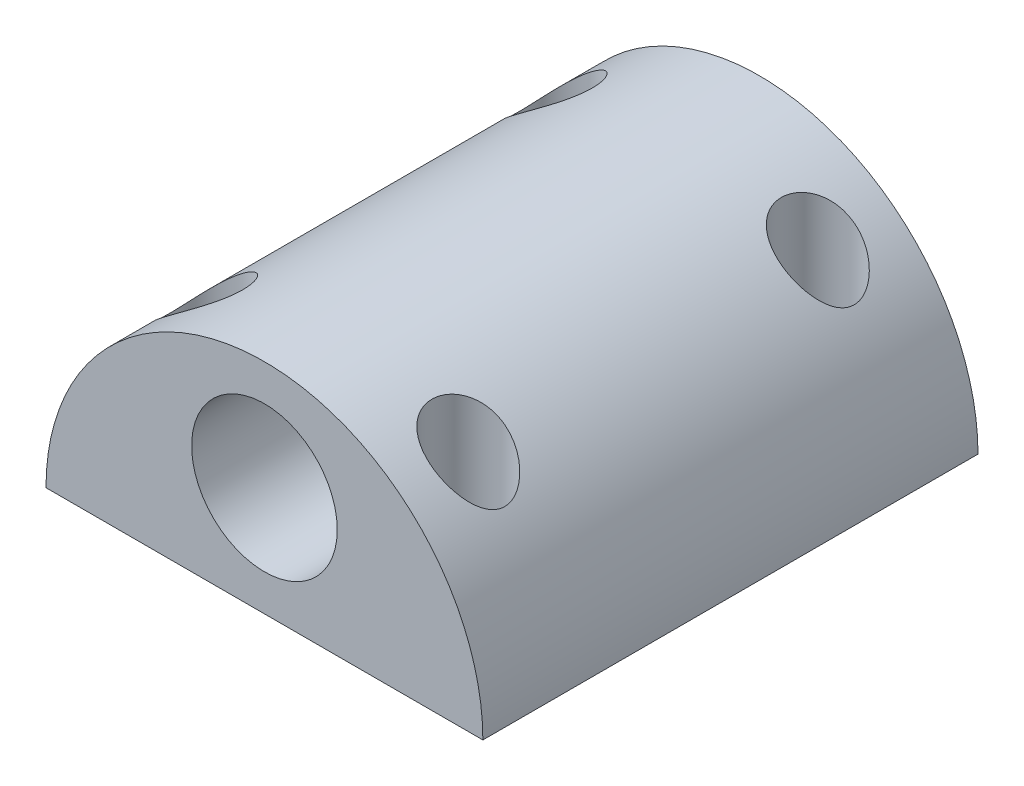
from build123d import *

# Parameters (mm, degrees)
ESQUISSE1_R               = 5
BOSS_EXTRU_1_DEPTH        = 34
ESQUISSE2_R               = 1.5
ENL_V_MAT_EXTRU_1_DEPTH   = 48.759815745
ENL_V_START               = -5
ESQUISSE4_R               = 2.5
ENL_V_MAT_EXTRU_2_DEPTH   = 43.75981591
SYM_TRIE2_START           = -5
SYM_TRIE2_COPY_1_SKETCH_R = 2.5
SYM_TRIE2_COPY_1_DEPTH    = 43.75981591


with BuildPart() as part:
    # Esquisse1 → Boss.-Extru.1 (new body)
    with BuildSketch(Plane.XY):
        with BuildLine():
            Line((0, 0), (30, 0))
            ThreePointArc((30, 0), (15, 15), (0, 0))
        make_face()
        with Locations((15, 7.5)):
            Circle(ESQUISSE1_R, mode=Mode.SUBTRACT)
    extrude(amount=BOSS_EXTRU_1_DEPTH)

    # Esquisse2 → Enlèv. mat.-Extru.1 (cut, through all)
    with BuildSketch(Plane.XZ):
        with Locations(Location((24, 29, 0), (0, 0, 270))):
            Circle(ESQUISSE2_R)
        with Locations(Location((24, 5, 0), (0, 0, 270))):
            Circle(ESQUISSE2_R)
        with Locations(Location((6, 5, 0), (0, 0, 270))):
            Circle(ESQUISSE2_R)
        with Locations(Location((6, 29, 0), (0, 0, 270))):
            Circle(ESQUISSE2_R)
    extrude(amount=-ENL_V_MAT_EXTRU_1_DEPTH, mode=Mode.SUBTRACT)

    # Esquisse4 → Enlèv. mat.-Extru.2 (cut, through all)
    with BuildSketch(Plane.XZ.offset(ENL_V_START)):
        with Locations(Location((24, 29, 0), (0, 0, 270))):
            Circle(ESQUISSE4_R)
    enl_v_mat_extru_2 = extrude(amount=-ENL_V_MAT_EXTRU_2_DEPTH, mode=Mode.SUBTRACT)

    # Symétrie1: Enlèv. mat.-Extru.2 across plane
    add(enl_v_mat_extru_2.mirror(Plane(origin=(15, 0, 0), x_dir=(0, 0, 1), z_dir=(1, 0, 0))), mode=Mode.SUBTRACT)

    # Symétrie2: Enlèv. mat.-Extru.2 across plane
    add(enl_v_mat_extru_2.mirror(Plane.XY.offset(17)), mode=Mode.SUBTRACT)

    # Symétrie2 copy 1 sketch → Symétrie2 copy 1 (cut, through all)
    with BuildSketch(Plane(origin=(30, 0, 34), x_dir=(-1, 0, 0), z_dir=(0, -1, 0)).offset(SYM_TRIE2_START)):
        with Locations(Location((24, 29, 0), (0, 0, 270))):
            Circle(SYM_TRIE2_COPY_1_SKETCH_R)
    extrude(amount=-SYM_TRIE2_COPY_1_DEPTH, mode=Mode.SUBTRACT)


solid = part.part
